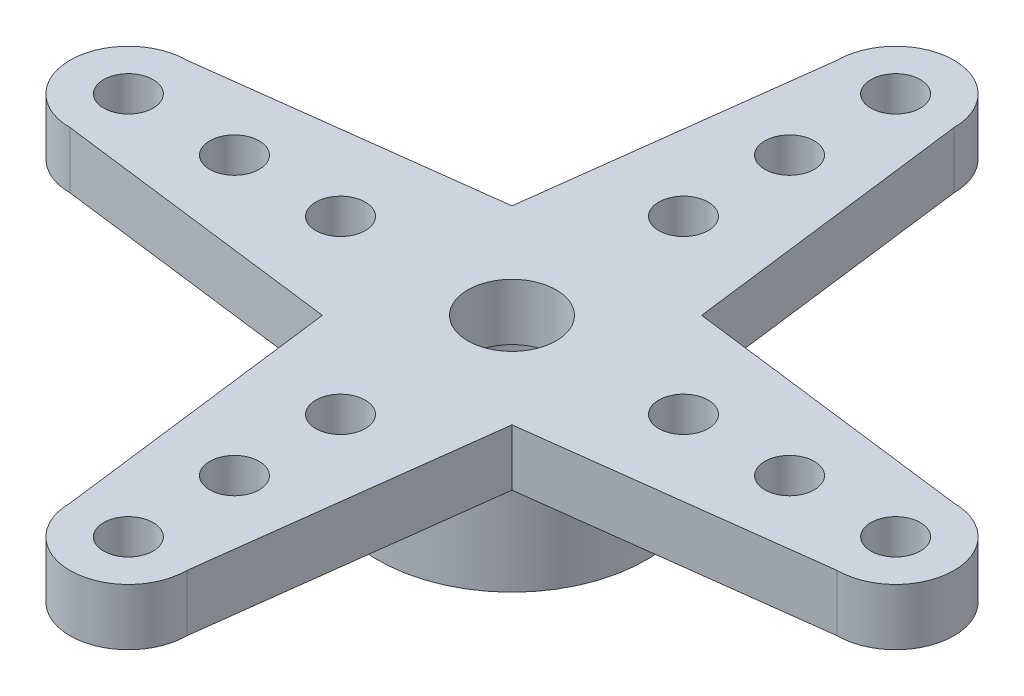
from build123d import *

# Parameters (mm, degrees)
SKETCH1_R           = 0.7
SKETCH1_R_2         = 1.25
BOSS_EXTRUDE1_DEPTH = 1.6
SKETCH2_R           = 3.792840445
SKETCH2_R_2         = 2.43
BOSS_EXTRUDE2_DEPTH = 2.5


with BuildPart() as part:
    # Sketch1 → Boss-Extrude1 (new body)
    with BuildSketch(Plane(origin=(0, 0, 0), x_dir=(1, 0, 0), z_dir=(0, 1, 0))):
        with BuildLine():
            Line((-10.84721718, -1.650301895), (-2.681943198, -2.681943198))
            Line((-2.681943198, -2.681943198), (-1.650301895, -10.84721718))
            ThreePointArc((-1.650301895, -10.84721718), (0, -12.5), (1.650301895, -10.84721718))
            Line((1.650301895, -10.84721718), (2.681943198, -2.681943198))
            Line((2.681943198, -2.681943198), (10.84721718, -1.650301895))
            ThreePointArc((10.84721718, -1.650301895), (12.5, 0), (10.84721718, 1.650301895))
            Line((10.84721718, 1.650301895), (2.681943198, 2.681943198))
            Line((2.681943198, 2.681943198), (1.650301895, 10.84721718))
            ThreePointArc((1.650301895, 10.84721718), (0, 12.5), (-1.650301895, 10.84721718))
            Line((-1.650301895, 10.84721718), (-2.681943198, 2.681943198))
            Line((-2.681943198, 2.681943198), (-10.84721718, 1.650301895))
            ThreePointArc((-10.84721718, 1.650301895), (-12.5, 0), (-10.84721718, -1.650301895))
        make_face()
        with Locations(Location((0, 4.849696243, 0), (0, 0, 270))):
            Circle(SKETCH1_R, mode=Mode.SUBTRACT)
        with Locations(Location((0, 7.849696243, 0), (0, 0, 270))):
            Circle(SKETCH1_R, mode=Mode.SUBTRACT)
        with Locations(Location((0, 10.849696243, 0), (0, 0, 270))):
            Circle(SKETCH1_R, mode=Mode.SUBTRACT)
        with Locations(Location((0, -4.849696243, 0), (0, 0, 90))):
            Circle(SKETCH1_R, mode=Mode.SUBTRACT)
        with Locations(Location((0, -7.849696243, 0), (0, 0, 90))):
            Circle(SKETCH1_R, mode=Mode.SUBTRACT)
        with Locations(Location((0, -10.849696243, 0), (0, 0, 90))):
            Circle(SKETCH1_R, mode=Mode.SUBTRACT)
        with Locations(Location((-10.849696243, 0, 0), (0, 0, 270))):
            Circle(SKETCH1_R, mode=Mode.SUBTRACT)
        with Locations(Location((-7.849696243, 0, 0), (0, 0, 270))):
            Circle(SKETCH1_R, mode=Mode.SUBTRACT)
        with Locations(Location((-4.849696243, 0, 0), (0, 0, 270))):
            Circle(SKETCH1_R, mode=Mode.SUBTRACT)
        with Locations(Location((10.849696243, 0, 0), (0, 0, 90))):
            Circle(SKETCH1_R, mode=Mode.SUBTRACT)
        with Locations(Location((4.849696243, 0, 0), (0, 0, 90))):
            Circle(SKETCH1_R, mode=Mode.SUBTRACT)
        with Locations(Location((7.849696243, 0, 0), (0, 0, 90))):
            Circle(SKETCH1_R, mode=Mode.SUBTRACT)
        with Locations(Location((0, 0, 0), (0, 0, 270))):
            Circle(SKETCH1_R_2, mode=Mode.SUBTRACT)
    extrude(amount=BOSS_EXTRUDE1_DEPTH)

    # Sketch2 → Boss-Extrude2 (add)
    with BuildSketch(Plane.XZ):
        with Locations(Location((0, 0, 0), (0, 0, 45))):
            Circle(SKETCH2_R)
        with Locations(Location((0, 0, 0), (0, 0, 270))):
            Circle(SKETCH2_R_2, mode=Mode.SUBTRACT)
    extrude(amount=BOSS_EXTRUDE2_DEPTH)


solid = part.part
